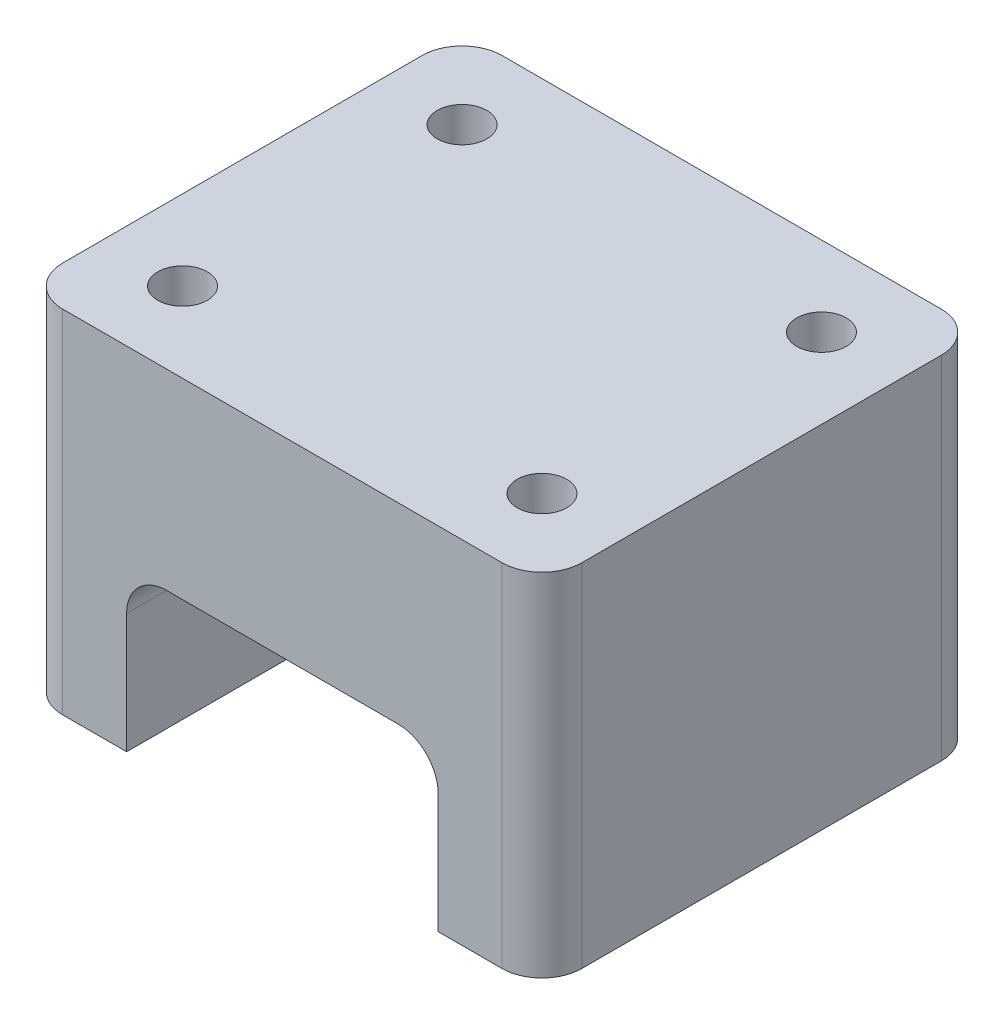
from build123d import *

# Parameters (mm, degrees)
SKETCH1_W           = 65
SKETCH1_H           = 55
BOSS_EXTRUDE1_DEPTH = 44
SKETCH2_W           = 39
SKETCH2_H           = 20
CUT_EXTRUDE1_DEPTH  = 96.843622636
FILLET1_R           = 5
SKETCH3_R           = 3.1
CUT_EXTRUDE2_DEPTH  = 8.5
SKETCH4_R           = 3.1
CUT_EXTRUDE3_DEPTH  = 10
FILLET2_R           = 5


with BuildPart() as part:
    # Sketch1 → Boss-Extrude1 (new body)
    with BuildSketch(Plane(origin=(0, 0, 0), x_dir=(1, 0, 0), z_dir=(0, 1, 0))):
        with Locations((32.5, 27.5)):
            Rectangle(SKETCH1_W, SKETCH1_H)
    extrude(amount=BOSS_EXTRUDE1_DEPTH)

    # Sketch2 → Cut-Extrude1 (cut, through all)
    with BuildSketch(Plane.XY):
        with Locations((32.5, 10)):
            Rectangle(SKETCH2_W, SKETCH2_H)
    extrude(amount=-CUT_EXTRUDE1_DEPTH, mode=Mode.SUBTRACT)

    # Fillet1
    fillet1_edges = [part.edges().sort_by_distance(p)[0] for p in [
        (52, 20, -27.5),
        (13, 20, -27.5),
    ]]
    fillet(fillet1_edges, radius=FILLET1_R)

    # Sketch3 → Cut-Extrude2 (cut)
    with BuildSketch(Plane.XZ):
        with Locations(Location((58.5, -6.5, 0), (0, 0, 270))):
            Circle(SKETCH3_R)
        with Locations(Location((58.5, -48.5, 0), (0, 0, 270))):
            Circle(SKETCH3_R)
        with Locations(Location((6.5, -48.5, 0), (0, 0, 270))):
            Circle(SKETCH3_R)
        with Locations(Location((6.5, -6.5, 0), (0, 0, 270))):
            Circle(SKETCH3_R)
    extrude(amount=-CUT_EXTRUDE2_DEPTH, mode=Mode.SUBTRACT)

    # Sketch4 → Cut-Extrude3 (cut)
    with BuildSketch(Plane(origin=(0, 44, 0), x_dir=(1, 0, 0), z_dir=(0, 1, 0))):
        with Locations(Location((10, 45, 0), (0, 0, 270))):
            Circle(SKETCH4_R)
        with Locations(Location((55, 45, 0), (0, 0, 270))):
            Circle(SKETCH4_R)
        with Locations(Location((55, 10, 0), (0, 0, 270))):
            Circle(SKETCH4_R)
        with Locations(Location((10, 10, 0), (0, 0, 270))):
            Circle(SKETCH4_R)
    extrude(amount=-CUT_EXTRUDE3_DEPTH, mode=Mode.SUBTRACT)

    # Fillet2
    fillet2_edges = [part.edges().sort_by_distance(p)[0] for p in [
        (0, 22, -55),
        (65, 22, -55),
        (65, 22, 0),
        (0, 22, 0),
    ]]
    fillet(fillet2_edges, radius=FILLET2_R)


solid = part.part
